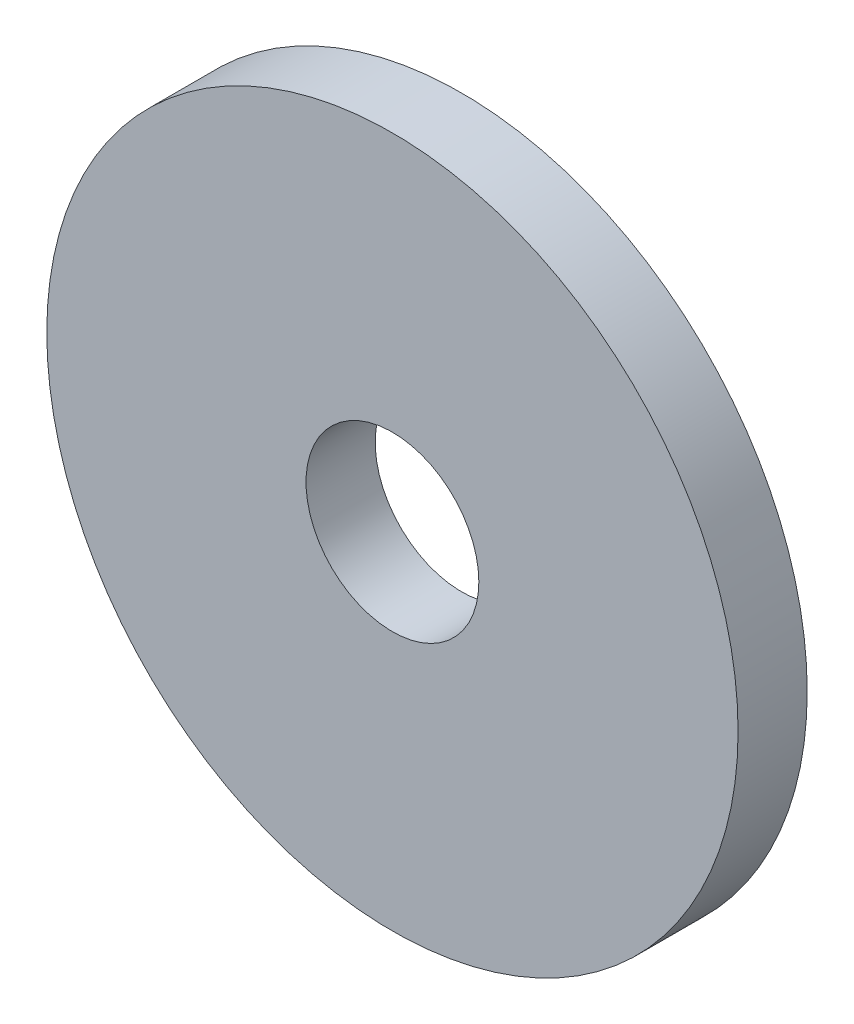
from build123d import *

# Parameters (mm, degrees)
SKETCH_1_R          = 10
EXTRUDE_1_DEPTH     = 2
SKETCH_2_R          = 2.5
CUT_EXTRUDE_1_DEPTH = 4


with BuildPart() as part:
    # 草图1 → 凸台-拉伸1 (new body)
    with BuildSketch(Plane.XY):
        Circle(SKETCH_1_R)
    extrude(amount=EXTRUDE_1_DEPTH)

    # 草图2 → 切除-拉伸1 (cut)
    with BuildSketch(Plane.XY.offset(2)):
        Circle(SKETCH_2_R)
    extrude(amount=-CUT_EXTRUDE_1_DEPTH, mode=Mode.SUBTRACT)


solid = part.part
